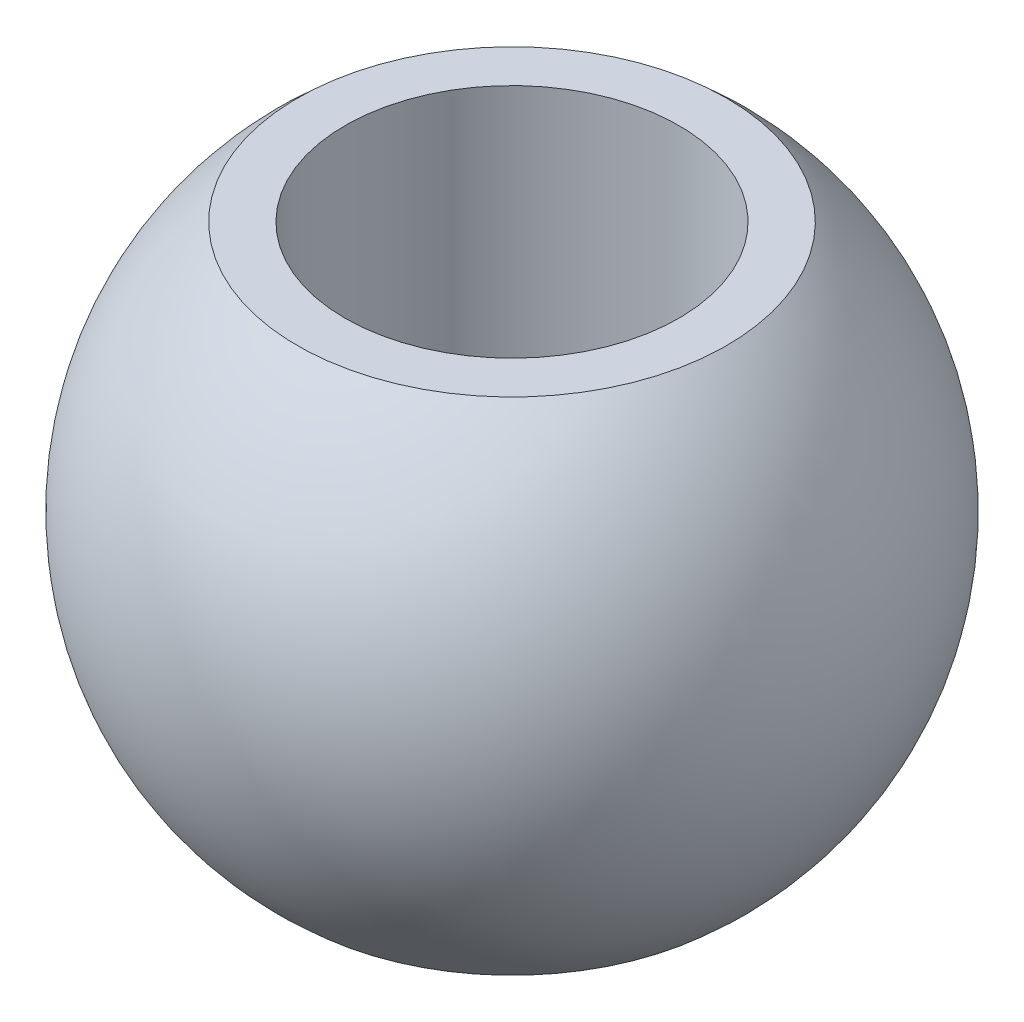
from build123d import *

# Parameters (mm, degrees)
SKETCH2_W          = 18.978879418
SKETCH2_H          = 2.502184335
SKETCH2_H_2        = 2.11907031
CUT_EXTRUDE1_DEPTH = 6
SKETCH3_R          = 4
CUT_EXTRUDE2_DEPTH = 17.395731152


with BuildPart() as part:
    # Sketch1 → Revolve1 (revolve)
    with BuildSketch(Plane.XY):
        with BuildLine():
            Line((-7.9, 0), (7.9, 0))
            ThreePointArc((7.9, 0), (0, 7.9), (-7.9, 0))
        make_face()
    revolve(axis=Axis((-7.9, 0, 0), (1, 0, 0)))

    # Sketch2 → Cut-Extrude1 (cut, symmetric)
    with BuildSketch(Plane.XY):
        with Locations((0, 7.251092168)):
            Rectangle(SKETCH2_W, SKETCH2_H)
        with Locations((0, -7.059535155)):
            Rectangle(SKETCH2_W, SKETCH2_H_2)
    extrude(amount=CUT_EXTRUDE1_DEPTH, both=True, mode=Mode.SUBTRACT)

    # Sketch3 → Cut-Extrude2 (cut, through all)
    with BuildSketch(Plane(origin=(0, 6, 0), x_dir=(1, 0, 0), z_dir=(0, 1, 0))):
        with Locations(Location((0, 0, 0), (0, 0, 270))):
            Circle(SKETCH3_R)
    extrude(amount=-CUT_EXTRUDE2_DEPTH, mode=Mode.SUBTRACT)


solid = part.part
